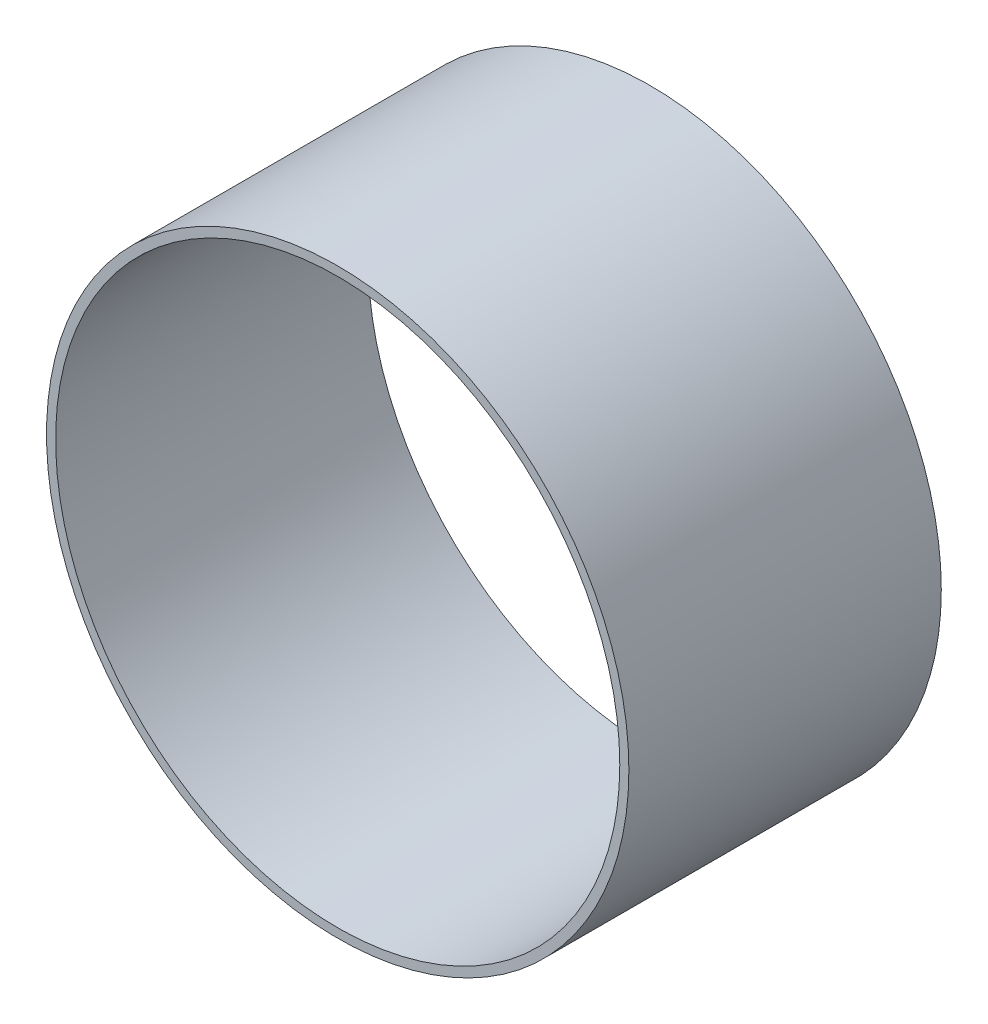
from build123d import *

# Parameters (mm, degrees)
RIM_REFERENCE_START = -44.5
SKETCH_1_R          = 96
SKETCH_1_R_2        = 93
RIM_REFERENCE_DEPTH = 103


with BuildPart() as part:
    # Эскиз1 → Rim_reference (new body)
    with BuildSketch(Plane.XY.offset(RIM_REFERENCE_START)):
        Circle(SKETCH_1_R)
        Circle(SKETCH_1_R_2, mode=Mode.SUBTRACT)
    extrude(amount=RIM_REFERENCE_DEPTH)


solid = part.part
